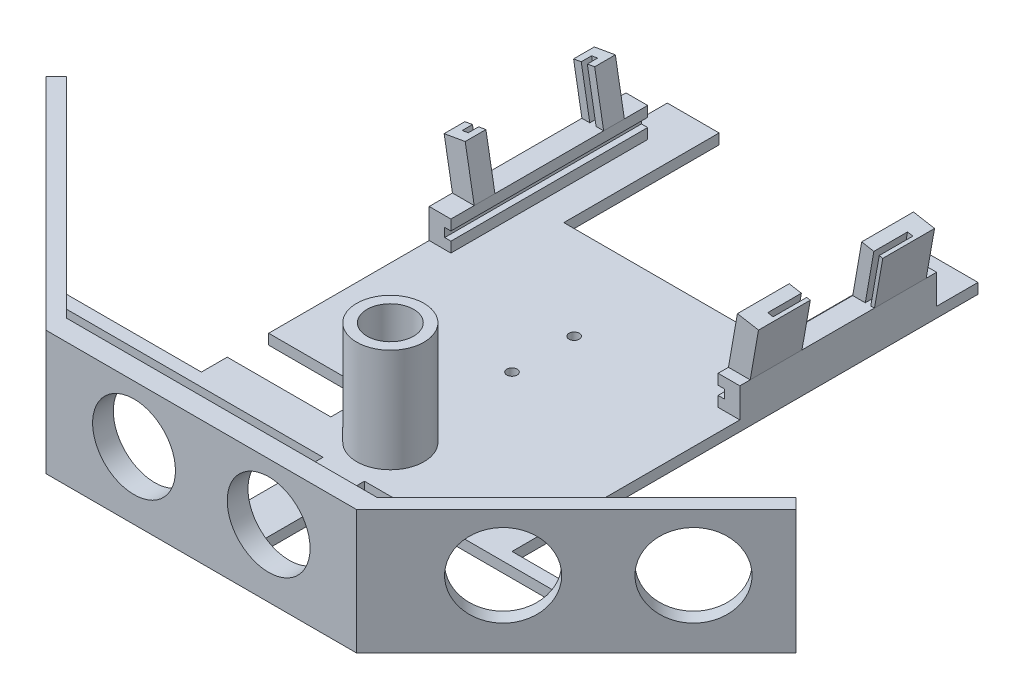
from build123d import *

# Parameters (mm, degrees)
SKETCH1_W           = 60
SKETCH1_H           = 22
SKETCH1_R           = 8
BOSS_EXTRUDE1_DEPTH = 4
BOSS_EXTRUDE2_DEPTH = 2
BOSS_EXTRUDE3_START = -70
BOSS_EXTRUDE3_DEPTH = 38
BOSS_EXTRUDE5_DEPTH = 10
BOSS_EXTRUDE6_DEPTH = 10
SKETCH10_R          = 1
CUT_EXTRUDE1_DEPTH  = 4
SKETCH12_W          = 24
SKETCH12_H          = 60
SKETCH12_R          = 8
BOSS_EXTRUDE7_DEPTH = 2.83
SKETCH13_R          = 6.5
SKETCH13_R_2        = 4.5
BOSS_EXTRUDE8_DEPTH = 20


with BuildPart() as part:
    # Sketch1 → Boss-Extrude1 (new body)
    with BuildSketch(Plane.XY):
        Rectangle(SKETCH1_W, SKETCH1_H)
        with Locations((-13, 0)):
            Circle(SKETCH1_R, mode=Mode.SUBTRACT)
        with Locations((13, 0)):
            Circle(SKETCH1_R, mode=Mode.SUBTRACT)
    extrude(amount=BOSS_EXTRUDE1_DEPTH)

    # Sketch2 → Boss-Extrude2 (add)
    with BuildSketch(Plane(origin=(0, -11, 0), x_dir=(-1, 0, 0), z_dir=(0, -1, 0))):
        Polygon((-30, 116), (-20, 116), (-20, 86), (20, 86), (20, 116), (30, 116), (30, 39), (10, 39), (10, 31), (30, 31), (30, 26), (60, 26), (30.002383175, -4), (30, -4), (-30, -4), (-60, 26), (-30, 26), align=None)
        Polygon((-53.5, 23.5), (-30, 0), (-4, 0), (-4, 23.5), align=None, mode=Mode.SUBTRACT)
        Polygon((53.49813318, 23.5), (30, 0), (4, 0), (4, 23.5), align=None, mode=Mode.SUBTRACT)
    extrude(amount=BOSS_EXTRUDE2_DEPTH)

    # Sketch4 → Boss-Extrude3 (add)
    with BuildSketch(Plane.XY.offset(BOSS_EXTRUDE3_START)):
        Polygon((-25.8, -11), (-25.8, -9), (-27, -9), (-27, -7.3), (-25.8, -7.3), (-25.8, -5.3), (-30, -5.3), (-30, -11), align=None)
        Polygon((30, -5.3), (30, -11), (25.8, -11), (25.8, -9), (27, -9), (27, -7.3), (25.8, -7.3), (25.8, -5.3), align=None)
    extrude(amount=-BOSS_EXTRUDE3_DEPTH)

    # Sketch7 → Boss-Extrude5 (add)
    with BuildSketch(Plane(origin=(0.128388188, -0.728125596, 0), x_dir=(0, 0, 1), z_dir=(-0.17364817766693402, 0.9848077530122075, 0))):
        Polygon((-74.5, -26.328375369), (-74.5, -30.464567932), (-78.5, -30.464567932), (-78.5, -28.964567932), (-76.5, -28.964567932), (-76.5, -27.764567932), (-78.5, -27.764567932), (-78.5, -26.328375369), align=None)
        Polygon((-101.5, -27.764567932), (-99.5, -27.764567932), (-99.5, -26.328375369), (-103.5, -26.328375369), (-103.5, -30.464567932), (-99.5, -30.464567932), (-99.5, -28.964567932), (-101.5, -28.964567932), align=None)
    extrude(amount=BOSS_EXTRUDE5_DEPTH)

    # Sketch8 → Boss-Extrude6 (add)
    with BuildSketch(Plane(origin=(-0.128388188, -0.728125596, 0), x_dir=(0, 0, 1), z_dir=(0.17364817766692736, 0.9848077530122086, 0))):
        Polygon((-82, 26.328375369), (-82, 28.714567932), (-75.5, 28.714567932), (-75.5, 29.764567932), (-82, 29.764567932), (-82, 30.464567932), (-72, 30.464567932), (-72, 26.328375369), align=None)
        Polygon((-96, 29.764567932), (-96, 30.464567932), (-106, 30.464567932), (-106, 26.328375369), (-96, 26.328375369), (-96, 28.714567932), (-102.5, 28.714567932), (-102.5, 29.764567932), align=None)
    extrude(amount=BOSS_EXTRUDE6_DEPTH)

    # Sketch10 → Cut-Extrude1 (cut)
    with BuildSketch(Plane.XZ.offset(13)):
        with Locations((0, -56)):
            Circle(SKETCH10_R)
        with Locations((0, -68)):
            Circle(SKETCH10_R)
    extrude(amount=-CUT_EXTRUDE1_DEPTH, mode=Mode.SUBTRACT)

    # Sketch12 → Boss-Extrude7 (add)
    with BuildSketch(Plane(origin=(17, 0, 17), x_dir=(0, 1, 0), z_dir=(0.7071067811865561, 0, 0.7071067811865389))):
        with Locations((-1, -48.384776311)):
            Rectangle(SKETCH12_W, SKETCH12_H)
        with Locations((0, -38.384776311)):
            Circle(SKETCH12_R, mode=Mode.SUBTRACT)
        with Locations((0, -64.384776311)):
            Circle(SKETCH12_R, mode=Mode.SUBTRACT)
    boss_extrude7 = extrude(amount=-BOSS_EXTRUDE7_DEPTH)

    # Mirror2: Boss-Extrude7 across plane
    add(boss_extrude7.mirror(Plane(origin=(0, 0, 0), x_dir=(0, 0, 1), z_dir=(1, 0, 0))))

    # Sketch13 → Boss-Extrude8 (add)
    with BuildSketch(Plane(origin=(0, -11, 0), x_dir=(1, 0, 0), z_dir=(0, 1, 0))):
        with Locations((0, 32.5)):
            Circle(SKETCH13_R)
        with Locations((0, 32.5)):
            Circle(SKETCH13_R_2, mode=Mode.SUBTRACT)
    extrude(amount=BOSS_EXTRUDE8_DEPTH)


solid = part.part
